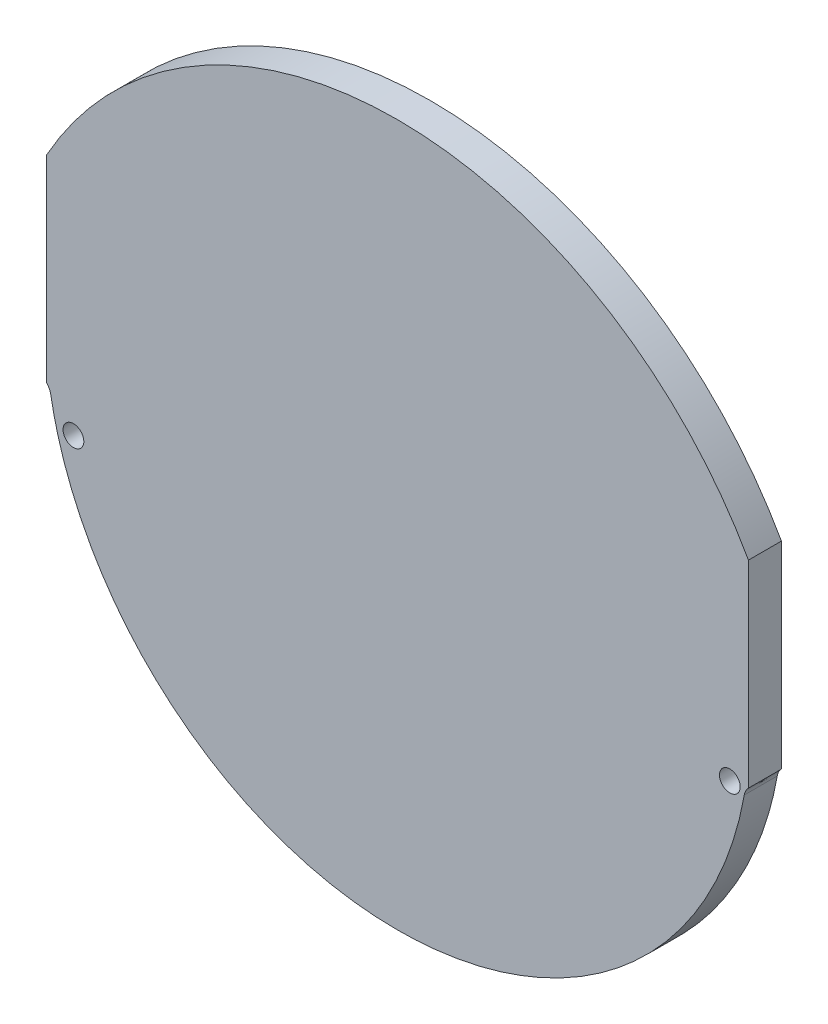
from build123d import *

# Parameters (mm, degrees)
BOSS_EXTRUDE1_DEPTH = 1.5875
SKETCH3_R           = 1
CUT_EXTRUDE2_DEPTH  = 3.175


with BuildPart() as part:
    # Sketch1 → Boss-Extrude1 (new, symmetric)
    with BuildSketch(Plane.XY.offset(264.790013628)):
        with BuildLine():
            Line((33.800017398, -5.067355161), (33.800017398, 13.955458653))
            ThreePointArc((33.800017398, 13.955458653), (0, 33.800390955), (-33.800017398, 13.955458653))
            Line((-33.800017398, 13.955458653), (-33.800017398, -5.067355161))
            add(Edge.make_bspline(
                [(-33.800017398, -5.067355161), (-33.694935477, -5.172128399), (-33.608288469, -5.290004795), (-33.472323961, -5.552290639), (-33.425425948, -5.692889236), (-33.399533932, -5.838970624)],
                knots=[0, 0, 0, 0, 0.5, 0.5, 1, 1, 1, 1], degree=3))
            add(Edge.make_bspline(
                [(-33.399533932, -5.838970624), (-33.052253285, -7.798309693), (-32.28122422, -10.647467269), (-31.145731134, -13.365691593), (-30.518165219, -14.703313718), (-30.29902031, -15.145610982), (-29.840887044, -16.023076775), (-29.601228036, -16.459250859), (-28.359208449, -18.607369492), (-27.22981433, -20.215826589), (-25.018856718, -22.840568094), (-23.995930567, -23.90437348), (-22.532682873, -25.242268373), (-22.158108065, -25.570446836), (-20.260791979, -27.161701153), (-18.652171115, -28.2877371), (-16.102983861, -29.756171424), (-15.230549353, -30.208885919), (-13.44029889, -31.040835285), (-12.518244043, -31.421602723), (-9.730335127, -32.436850643), (-7.835048114, -32.947048229), (-4.936180491, -33.458234156), (-3.960569712, -33.586283528), (-1.990568761, -33.757071458), (-0.994552943, -33.799592721), (7.014e-06, -33.799609106)],
                knots=[0, 0, 0, 0, 0.125, 0.1875, 0.1875, 0.21875, 0.21875, 0.25, 0.25, 0.375, 0.375, 0.46875, 0.46875, 0.5, 0.5, 0.625, 0.625, 0.6875, 0.6875, 0.75, 0.75, 0.875, 0.875, 0.9375, 0.9375, 1, 1, 1, 1], degree=3))
            add(Edge.make_bspline(
                [(7.014e-06, -33.799609106), (1.987875992, -33.799575566), (3.94703991, -33.631115611), (6.842232548, -33.122877847), (8.278942061, -32.804880827), (9.699244221, -32.390613968), (10.642458673, -32.092998308), (11.113286404, -31.933080905), (13.444877358, -31.084762204), (15.228063078, -30.258192227), (18.202438097, -28.548252781), (19.430049544, -27.730513432), (21.002878368, -26.524895287), (21.391487804, -26.213219806), (23.290603811, -24.621354585), (24.683841541, -23.235802325), (26.897817983, -20.611786452), (27.77410108, -19.422700527), (28.842940769, -17.748765821), (29.101464741, -17.323406575), (30.340761198, -15.181007143), (31.176382916, -13.403126413), (32.193288505, -10.639212594), (32.492355328, -9.701528607), (33.008528869, -7.792516567), (33.225825771, -6.819022893), (33.399533932, -5.838970624)],
                knots=[0, 0, 0, 0, 0.125, 0.125, 0.1875, 0.21875, 0.21875, 0.25, 0.25, 0.375, 0.375, 0.46875, 0.46875, 0.5, 0.5, 0.625, 0.625, 0.71875, 0.71875, 0.75, 0.75, 0.875, 0.875, 0.9375, 0.9375, 1, 1, 1, 1], degree=3))
            add(Edge.make_bspline(
                [(33.399533932, -5.838970624), (33.425419923, -5.692923228), (33.471627634, -5.554074987), (33.607200861, -5.29166755), (33.694927142, -5.172136709), (33.800017398, -5.067355161)],
                knots=[0, 0, 0, 0, 0.5, 0.5, 1, 1, 1, 1], degree=3))
        make_face()
    extrude(amount=BOSS_EXTRUDE1_DEPTH, both=True)

    # Sketch3 → Cut-Extrude2 (cut)
    with BuildSketch(Plane.XY.offset(266.377513628)):
        with Locations((-31.216064399, -8.164436653)):
            Circle(SKETCH3_R)
        with Locations((32.009302375, -5.358989516)):
            Circle(SKETCH3_R)
    extrude(amount=-CUT_EXTRUDE2_DEPTH, mode=Mode.SUBTRACT)


solid = part.part
